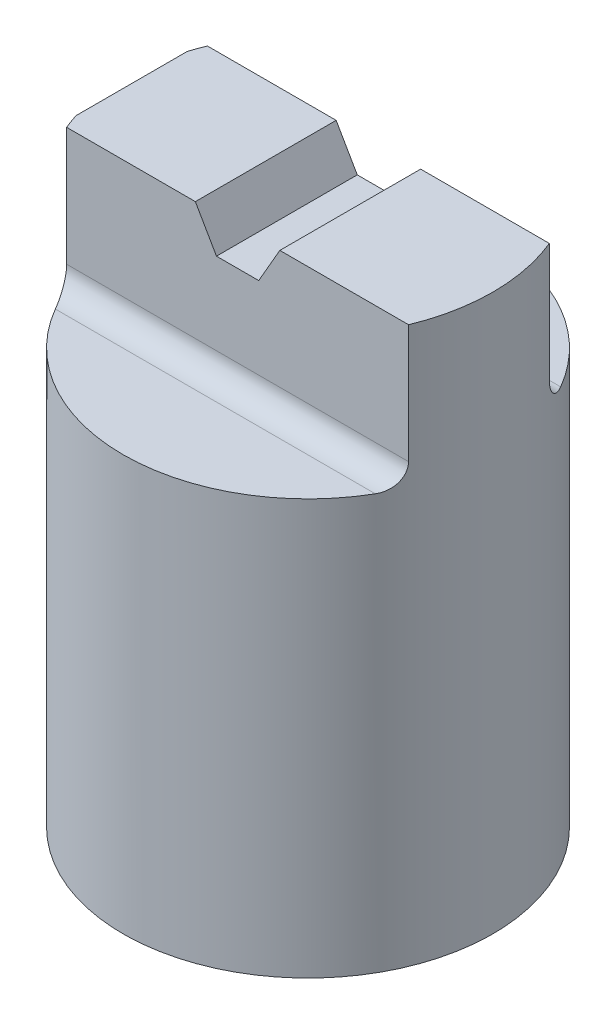
from build123d import *

# Parameters (mm, degrees)
CROQUIS4_R                  = 12.6746
SALIENTE_EXTRUIR6_DEPTH     = 38.1
CORTAR_EXTRUIR2_DEPTH       = 38.1
CORTAR_EXTRUIR2_DEPTH_BACK  = 38.1
CORTAR_EXTRUIR8_DEPTH       = 48.26
CORTAR_EXTRUIR10_DEPTH      = 55.88
CORTAR_EXTRUIR11_DEPTH      = 38.1
CORTAR_EXTRUIR11_DEPTH_BACK = 40.64
CORTAR_EXTRUIR12_DEPTH      = 0.254
CROQUIS36_W                 = 0.396875
CROQUIS36_H                 = 0.824278846
CORTAR_EXTRUIR13_DEPTH      = 0.254


with BuildPart() as part:
    # Croquis4 → Saliente-Extruir6 (new body)
    with BuildSketch(Plane(origin=(0, 0, 0), x_dir=(1, 0, 0), z_dir=(0, 1, 0))):
        with Locations(Location((0, 0, 0), (0, 0, 90))):
            Circle(CROQUIS4_R)
    extrude(amount=SALIENTE_EXTRUIR6_DEPTH)

    # Croquis7 → Cortar-Extruir2 (cut, two sides: drawn at the far end of the back side and taken through both)
    with BuildSketch(Plane.XY.offset(-CORTAR_EXTRUIR2_DEPTH_BACK)):
        Polygon((-2.8956, 38.1), (-1.4478, 35.5854), (1.4478, 35.5854), (2.8956, 38.1), align=None)
    extrude(amount=CORTAR_EXTRUIR2_DEPTH + CORTAR_EXTRUIR2_DEPTH_BACK, mode=Mode.SUBTRACT)

    # Croquis26 → Cortar-Extruir8 (cut)
    with BuildSketch(Plane(origin=(0, 0, 0), x_dir=(1, 0, 0), z_dir=(0, 1, 0))):
        with BuildLine():
            Line((-12.0904, 0), (-12.0904, -3.803644699))
            ThreePointArc((-12.0904, -3.803644699), (-12.6746, 0), (-12.0904, 3.803644699))
            Line((-12.0904, 3.803644699), (-12.0904, 0))
        make_face()
    extrude(amount=CORTAR_EXTRUIR8_DEPTH, mode=Mode.SUBTRACT)

    # Croquis32 → Cortar-Extruir10 (cut)
    with BuildSketch(Plane.XZ):
        with BuildLine():
            Line((0, -12.0904), (7.192790166, -12.0904))
            ThreePointArc((7.192790166, -12.0904), (0.79924589, -13.146144279), (-5.594298385, -12.0904))
            Line((-5.594298385, -12.0904), (0, -12.0904))
        make_face()
    extrude(amount=-CORTAR_EXTRUIR10_DEPTH, mode=Mode.SUBTRACT)

    # Croquis34 → Cortar-Extruir11 (cut, two sides: drawn at the far end of the back side and taken through both)
    with BuildSketch(Plane(origin=(0, 0, 0), x_dir=(0, 0, -1), z_dir=(1, 0, 0)).offset(-CORTAR_EXTRUIR11_DEPTH_BACK)):
        with BuildLine():
            Line((-4.826, 38.1), (-4.826, 29.972))
            ThreePointArc((-4.826, 29.972), (-5.272369265, 28.894369265), (-6.35, 28.448))
            Line((-6.35, 28.448), (-12.6746, 28.448))
            Line((-12.6746, 28.448), (-12.6746, 38.1))
            Line((-12.6746, 38.1), (-4.826, 38.1))
        make_face()
        with BuildLine():
            Line((4.826, 38.1), (4.826, 29.972))
            ThreePointArc((4.826, 29.972), (5.272369265, 28.894369265), (6.35, 28.448))
            Line((6.35, 28.448), (12.0904, 28.448))
            Line((12.0904, 28.448), (12.0904, 38.1))
            Line((12.0904, 38.1), (4.826, 38.1))
        make_face()
    extrude(amount=CORTAR_EXTRUIR11_DEPTH + CORTAR_EXTRUIR11_DEPTH_BACK, mode=Mode.SUBTRACT)

    # Croquis35 → Cortar-Extruir12 (cut)
    with BuildSketch(Plane.ZY.offset(12.0904)):
        with BuildLine():
            Line((0.041826923, 29.436302735), (0.041826923, 29.750405299))
            add(Edge.make_bspline(
                [(0.041826923, 29.750405299), (0.083498016, 29.748358494), (0.165338934, 29.744338625), (0.284659934, 29.725505405), (0.398725252, 29.698582372), (0.506556988, 29.660426155), (0.609443283, 29.61330656), (0.706017925, 29.55561854), (0.797239406, 29.488591911), (0.881380601, 29.412349634), (0.958296174, 29.329619737), (1.025419589, 29.240897901), (1.08148344, 29.147096017), (1.1286064, 29.049027685), (1.163934955, 28.945558713), (1.190159677, 28.837678151), (1.205935182, 28.724898389), (1.207631084, 28.648058453), (1.20849359, 28.608979017)],
                knots=[0, 0, 0, 0, 1.100776268, 2.161895295, 3.184016182, 4.190939212, 5.176500551, 6.166955529, 7.155448256, 8.160289653, 9.16017456, 10.133824356, 11.091467644, 12.04088621, 13.000931625, 13.972173743, 14.968683325, 16, 16, 16, 16], degree=3))
            add(Edge.make_bspline(
                [(1.20849359, 28.608979017), (1.207595133, 28.570600943), (1.205829698, 28.495189398), (1.190668669, 28.385127384), (1.166923078, 28.280350089), (1.133607661, 28.181062323), (1.088823234, 28.088056258), (1.035025695, 28.000633213), (0.972805864, 27.917752403), (0.89955205, 27.843145619), (0.821349666, 27.77463754), (0.737861762, 27.715535285), (0.651632477, 27.664922121), (0.562004275, 27.622734441), (0.468133247, 27.591678302), (0.371386044, 27.568100094), (0.270761233, 27.554772681), (0.202654677, 27.552727257), (0.168028846, 27.55168735)],
                knots=[0, 0, 0, 0, 1.111607364, 2.184268762, 3.212621178, 4.221274766, 5.211760367, 6.196651075, 7.1921475, 8.207485113, 9.220403448, 10.201281604, 11.166441695, 12.114753415, 13.065576456, 14.026450734, 14.996634279, 16, 16, 16, 16], degree=3))
            add(Edge.make_bspline(
                [(0.168028846, 27.55168735), (0.119281012, 27.553380613), (0.022640798, 27.556737424), (-0.119374065, 27.585451801), (-0.256967484, 27.630298312), (-0.367704786, 27.684295669), (-0.45693828, 27.738768113), (-0.530406985, 27.78785562), (-0.609512453, 27.845320431), (-0.69398979, 27.911998929), (-0.784500696, 27.986511802), (-0.880990491, 28.069533965), (-0.982462261, 28.161657447), (-1.051767862, 28.226315948), (-1.087680288, 28.259820363)],
                knots=[0, 0, 0, 0, 1.184426356, 2.348067706, 3.509069118, 4.696110526, 5.333549288, 6.050745305, 6.844228056, 7.710549037, 8.667450064, 9.695053472, 10.805634456, 12, 12, 12, 12], degree=3))
            Line((-1.087680288, 28.259820363), (-2.022275641, 29.135521485))
            Line((-2.022275641, 29.135521485), (-2.022275641, 27.506815555))
            Line((-2.022275641, 27.506815555), (-2.38125, 27.506815555))
            Line((-2.38125, 27.506815555), (-2.38125, 29.885020683))
            Line((-2.38125, 29.885020683), (-0.932732372, 28.527648889))
            add(Edge.make_bspline(
                [(-0.932732372, 28.527648889), (-0.898235947, 28.494598662), (-0.831975374, 28.431115941), (-0.735207659, 28.341364147), (-0.645540323, 28.260622937), (-0.562576029, 28.188838753), (-0.486785108, 28.125952529), (-0.417573603, 28.072165474), (-0.355535468, 28.027239858), (-0.282655661, 27.979628068), (-0.193568131, 27.934227066), (-0.085246136, 27.894324231), (0.026509457, 27.870167598), (0.102007707, 27.867254984), (0.139983974, 27.865789914)],
                knots=[0, 0, 0, 0, 1.329530082, 2.553755191, 3.672934919, 4.687409497, 5.60679272, 6.413407421, 7.126401618, 7.737995624, 8.834647426, 9.90044882, 10.943907757, 12, 12, 12, 12], degree=3))
            add(Edge.make_bspline(
                [(0.139983974, 27.865789914), (0.163868012, 27.866419126), (0.210938863, 27.867659182), (0.279906757, 27.878810578), (0.346692288, 27.895194192), (0.4104697, 27.920446402), (0.472493372, 27.950786003), (0.53087759, 27.98954708), (0.587612533, 28.033840813), (0.640752807, 28.085219371), (0.68943755, 28.14162348), (0.732560711, 28.201219665), (0.768600063, 28.264269264), (0.798143496, 28.330509522), (0.821318894, 28.399754954), (0.837377469, 28.472139709), (0.847459954, 28.547463723), (0.848824126, 28.598897219), (0.849519231, 28.625104818)],
                knots=[0, 0, 0, 0, 0.991504627, 1.954065223, 2.895985987, 3.842598665, 4.797835564, 5.759220273, 6.74786863, 7.784730864, 8.824135544, 9.839918996, 10.835834653, 11.835434876, 12.84861661, 13.863796685, 14.911511676, 16, 16, 16, 16], degree=3))
            add(Edge.make_bspline(
                [(0.849519231, 28.625104818), (0.848804415, 28.652475772), (0.847400634, 28.706227807), (0.837574902, 28.785145116), (0.820640229, 28.860437167), (0.797423151, 28.932256373), (0.768192666, 29.00067193), (0.731082364, 29.065065225), (0.687541169, 29.126024148), (0.637906583, 29.183436738), (0.582384417, 29.236189901), (0.521253649, 29.283513774), (0.454116634, 29.323876036), (0.382489792, 29.359655364), (0.304468657, 29.387031845), (0.221943858, 29.410432998), (0.133742916, 29.427432205), (0.072974465, 29.433296781), (0.041826923, 29.436302735)],
                knots=[0, 0, 0, 0, 1.031212865, 2.025131798, 2.990757446, 3.934781266, 4.865570067, 5.788494791, 6.729227313, 7.684356718, 8.643577152, 9.610526866, 10.590658432, 11.59095419, 12.621640561, 13.700587263, 14.82141059, 16, 16, 16, 16], degree=3))
        make_face()
        with BuildLine():
            Line((0.311057692, 32.128610427), (0.311057692, 32.442712991))
            add(Edge.make_bspline(
                [(0.311057692, 32.442712991), (0.346290176, 32.43420344), (0.415166801, 32.417567965), (0.513574062, 32.382870391), (0.606697583, 32.345071136), (0.692793657, 32.299682032), (0.773592559, 32.250173277), (0.847261684, 32.193450556), (0.915674649, 32.132130833), (0.976387887, 32.064305884), (1.031365616, 31.993177222), (1.078240673, 31.917742603), (1.118564826, 31.839519709), (1.151785058, 31.757966576), (1.176810582, 31.672840404), (1.194967387, 31.584910781), (1.206758502, 31.493947281), (1.207909265, 31.43219969), (1.20849359, 31.400846004)],
                knots=[0, 0, 0, 0, 1.162005537, 2.271625781, 3.343758855, 4.383309926, 5.390229558, 6.379919256, 7.361854164, 8.333198761, 9.295911338, 10.242430842, 11.177959212, 12.116337295, 13.062827104, 14.020064771, 14.994644689, 16, 16, 16, 16], degree=3))
            add(Edge.make_bspline(
                [(1.20849359, 31.400846004), (1.207114359, 31.355163262), (1.204385984, 31.264794251), (1.179471548, 31.132031204), (1.140046415, 31.004004385), (1.085572688, 30.882115137), (1.018385375, 30.768896704), (0.938420638, 30.668160518), (0.847221337, 30.581272007), (0.746488772, 30.508377629), (0.638833263, 30.45130263), (0.528033106, 30.409216257), (0.414351134, 30.383594576), (0.337593855, 30.380274019), (0.299138622, 30.378610427)],
                knots=[0, 0, 0, 0, 1.083050992, 2.142477498, 3.193116406, 4.255571735, 5.30263384, 6.308962982, 7.297363603, 8.282367274, 9.249857812, 10.179914175, 11.08814088, 12, 12, 12, 12], degree=3))
            add(Edge.make_bspline(
                [(0.299138622, 30.378610427), (0.262131827, 30.379774018), (0.189715273, 30.382050985), (0.083993775, 30.401384691), (-0.015647825, 30.433920954), (-0.109628987, 30.478990716), (-0.197353827, 30.537332266), (-0.279019718, 30.608004963), (-0.354988876, 30.691507625), (-0.398508349, 30.754786563), (-0.420913462, 30.787364433)],
                knots=[0, 0, 0, 0, 1.024540389, 2.004866551, 2.965041327, 3.920577974, 4.882998113, 5.874504559, 6.905732034, 8, 8, 8, 8], degree=3))
            add(Edge.make_bspline(
                [(-0.420913462, 30.787364433), (-0.438891633, 30.750132679), (-0.474511591, 30.676365805), (-0.544367348, 30.575815275), (-0.625023696, 30.4845374), (-0.687966348, 30.433633681), (-0.719591346, 30.408057542)],
                knots=[0, 0, 0, 0, 1.015518401, 2.012035669, 3.001164323, 4, 4, 4, 4], degree=3))
            add(Edge.make_bspline(
                [(-0.719591346, 30.408057542), (-0.74264664, 30.391209345), (-0.788379683, 30.35778885), (-0.861952008, 30.31665347), (-0.93609624, 30.278908986), (-1.013727633, 30.251130138), (-1.09235253, 30.227158093), (-1.173654605, 30.211385286), (-1.256861419, 30.201259775), (-1.313178124, 30.199837946), (-1.341486378, 30.199123247)],
                knots=[0, 0, 0, 0, 1.02516404, 2.033540309, 3.025129118, 4.011046665, 4.991655828, 5.976607087, 6.982917762, 8, 8, 8, 8], degree=3))
            add(Edge.make_bspline(
                [(-1.341486378, 30.199123247), (-1.390494151, 30.200921712), (-1.488279064, 30.204510179), (-1.632783018, 30.236454982), (-1.773793757, 30.286263725), (-1.909221962, 30.355759594), (-2.035668539, 30.441744239), (-2.148290569, 30.544607245), (-2.245749483, 30.661848029), (-2.326916131, 30.792699273), (-2.391845947, 30.934403957), (-2.436900154, 31.085982935), (-2.466247035, 31.245232067), (-2.469393782, 31.354439492), (-2.47099359, 31.409960587)],
                knots=[0, 0, 0, 0, 0.95570045, 1.906903359, 2.87519758, 3.868912786, 4.869932978, 5.851730567, 6.836639976, 7.83677598, 8.849487602, 9.869908895, 10.917060885, 12, 12, 12, 12], degree=3))
            add(Edge.make_bspline(
                [(-2.47099359, 31.409960587), (-2.470125376, 31.447379888), (-2.468417022, 31.521008593), (-2.456738421, 31.629252091), (-2.435408416, 31.73257379), (-2.406705111, 31.831113388), (-2.370313368, 31.924958425), (-2.32499467, 32.01382253), (-2.271683168, 32.098252423), (-2.209749581, 32.177451374), (-2.140468241, 32.251409942), (-2.062609231, 32.318162666), (-1.977611827, 32.378822459), (-1.884488771, 32.431765098), (-1.784443513, 32.479402051), (-1.676195015, 32.518583007), (-1.560710993, 32.553068576), (-1.480233253, 32.56910204), (-1.438942308, 32.577328376)],
                knots=[0, 0, 0, 0, 1.048658725, 2.063410685, 3.046034179, 4.001477787, 4.936774919, 5.862367409, 6.792675028, 7.730719943, 8.675894397, 9.627829632, 10.600096036, 11.597688215, 12.626045268, 13.701542398, 14.82072376, 16, 16, 16, 16], degree=3))
            Line((-1.438942308, 32.577328376), (-1.438942308, 32.263225812))
            add(Edge.make_bspline(
                [(-1.438942308, 32.263225812), (-1.465891321, 32.25504252), (-1.518309493, 32.239125307), (-1.593749798, 32.212031009), (-1.662907851, 32.181162737), (-1.726290973, 32.148048179), (-1.784523376, 32.113269733), (-1.836065245, 32.074354808), (-1.883180447, 32.034185662), (-1.909725059, 32.003906309), (-1.922716346, 31.98908719)],
                knots=[0, 0, 0, 0, 1.198163088, 2.33053128, 3.407730985, 4.417276592, 5.372219308, 6.28897303, 7.162600585, 8, 8, 8, 8], degree=3))
            add(Edge.make_bspline(
                [(-1.922716346, 31.98908719), (-1.93782468, 31.969490613), (-1.967994712, 31.93035795), (-2.00649634, 31.866589719), (-2.039857366, 31.799524833), (-2.065341061, 31.727710159), (-2.086918722, 31.652695389), (-2.101039241, 31.573268023), (-2.110727413, 31.490128806), (-2.111582344, 31.433361043), (-2.112019231, 31.404351613)],
                knots=[0, 0, 0, 0, 0.946170439, 1.889420265, 2.845303464, 3.807233317, 4.801018734, 5.828864929, 6.890507805, 8, 8, 8, 8], degree=3))
            add(Edge.make_bspline(
                [(-2.112019231, 31.404351613), (-2.111404327, 31.371597667), (-2.110201936, 31.307550153), (-2.099112235, 31.214101488), (-2.083031823, 31.125171908), (-2.057878932, 31.041668939), (-2.027703885, 30.962456311), (-1.988199209, 30.889302278), (-1.943585065, 30.820056203), (-1.891690234, 30.756746675), (-1.835597539, 30.699670039), (-1.776088189, 30.65034952), (-1.71500736, 30.60763231), (-1.650930161, 30.573294802), (-1.584485137, 30.546132221), (-1.515423583, 30.527652232), (-1.444327042, 30.514799862), (-1.395997975, 30.513753365), (-1.371634615, 30.513225812)],
                knots=[0, 0, 0, 0, 1.216990249, 2.379719373, 3.493992396, 4.571561497, 5.616923107, 6.638958652, 7.655775068, 8.674704564, 9.676001865, 10.625896028, 11.54399481, 12.441854662, 13.322657739, 14.20572845, 15.095482574, 16, 16, 16, 16], degree=3))
            add(Edge.make_bspline(
                [(-1.371634615, 30.513225812), (-1.33902324, 30.514756086), (-1.273962758, 30.51780902), (-1.178245736, 30.541118007), (-1.08602017, 30.579455283), (-0.998872816, 30.633134014), (-0.918064657, 30.69844596), (-0.846246013, 30.774758903), (-0.786389314, 30.862260041), (-0.745186208, 30.943312717), (-0.71772607, 31.015279721), (-0.698471535, 31.07674526), (-0.683079802, 31.145618676), (-0.66819136, 31.221073159), (-0.655709835, 31.303426936), (-0.645256069, 31.392754205), (-0.636904554, 31.489090902), (-0.633172953, 31.555781934), (-0.63125, 31.590148889)],
                knots=[0, 0, 0, 0, 1.070481957, 2.135637345, 3.216366529, 4.339485895, 5.485746587, 6.620975969, 7.768829582, 8.956804399, 9.598399438, 10.297751078, 11.070570279, 11.915248466, 12.824061284, 13.805856426, 14.869322739, 16, 16, 16, 16], degree=3))
            Line((-0.63125, 31.590148889), (-0.272275641, 31.590148889))
            add(Edge.make_bspline(
                [(-0.272275641, 31.590148889), (-0.271537633, 31.54684892), (-0.270092058, 31.462034917), (-0.252729148, 31.338123765), (-0.228440721, 31.219493483), (-0.192096321, 31.10885194), (-0.148472667, 31.008334931), (-0.099283811, 30.920649582), (-0.043555045, 30.847874001), (0.017982246, 30.789826365), (0.084752421, 30.747221461), (0.153615919, 30.715242261), (0.226174963, 30.696494758), (0.275664947, 30.693978019), (0.300540865, 30.692712991)],
                knots=[0, 0, 0, 0, 1.321708579, 2.588902423, 3.815526512, 5.016621128, 6.138757764, 7.158873101, 8.079948563, 8.928590313, 9.728601868, 10.489025425, 11.240515403, 12, 12, 12, 12], degree=3))
            add(Edge.make_bspline(
                [(0.300540865, 30.692712991), (0.318818654, 30.693127354), (0.355181449, 30.693951709), (0.408305873, 30.704349694), (0.459809226, 30.719971093), (0.509457816, 30.741460946), (0.556963459, 30.77017231), (0.602384437, 30.804635511), (0.646481957, 30.844867184), (0.68714634, 30.891918781), (0.725503266, 30.942857154), (0.758661402, 30.998161599), (0.786766216, 31.05661231), (0.809986783, 31.118263037), (0.827443025, 31.18336075), (0.83997972, 31.251586697), (0.847817137, 31.32307455), (0.848945586, 31.371846259), (0.849519231, 31.396639273)],
                knots=[0, 0, 0, 0, 0.884317272, 1.759307272, 2.611736065, 3.488921043, 4.37244062, 5.294096728, 6.247679003, 7.258495569, 8.302441962, 9.333537773, 10.376747089, 11.440883505, 12.520330301, 13.637364711, 14.798958396, 16, 16, 16, 16], degree=3))
            add(Edge.make_bspline(
                [(0.849519231, 31.396639273), (0.848130568, 31.436492258), (0.845418186, 31.514334407), (0.821577569, 31.626530975), (0.783804571, 31.730725203), (0.738193787, 31.810100186), (0.693324995, 31.868812931), (0.654724373, 31.911572902), (0.610959174, 31.952797895), (0.560828968, 31.990870202), (0.506057529, 32.028071198), (0.446343197, 32.064045669), (0.380834624, 32.097638113), (0.334767108, 32.118086384), (0.311057692, 32.128610427)],
                knots=[0, 0, 0, 0, 1.4727372, 2.876598283, 4.222346151, 5.558423782, 6.24313385, 6.953189256, 7.68715613, 8.463578749, 9.278833271, 10.135787152, 11.040551781, 12, 12, 12, 12], degree=3))
        make_face()
        Polygon((1.20849359, 32.846559145), (-2.874839744, 34.310501453), (-2.874839744, 34.64143094), (1.20849359, 33.177488632), align=None)
        Polygon((1.11875, 37.154251453), (1.11875, 35.000405299), (-2.47099359, 36.840148889), (-2.321654647, 37.111483023), (0.759775641, 35.531855619), (0.759775641, 37.154251453), align=None)
    extrude(amount=-CORTAR_EXTRUIR12_DEPTH, mode=Mode.SUBTRACT)

    # Croquis36 → Cortar-Extruir13 (cut)
    # profile 1 of 10: a face of its own
    with BuildSketch(Plane.XZ):
        with BuildLine():
            Line((-8.428764122, -8.563341346), (-8.428764122, -8.1359375))
            Line((-8.428764122, -8.1359375), (-6.87942518, -8.1359375))
            add(Edge.make_bspline(
                [(-6.87942518, -8.1359375), (-6.863362417, -8.135913315), (-6.832337355, -8.135866601), (-6.787824768, -8.133632054), (-6.746756653, -8.131526022), (-6.7094659, -8.127942675), (-6.675836751, -8.122321942), (-6.645745306, -8.117074197), (-6.619459735, -8.109879442), (-6.589519399, -8.099105263), (-6.555884642, -8.082284335), (-6.520432227, -8.055604857), (-6.488876585, -8.023745041), (-6.462380996, -7.986225239), (-6.439970721, -7.944335684), (-6.425148202, -7.89725085), (-6.415094353, -7.846501397), (-6.414279328, -7.811144215), (-6.413860276, -7.792964994)],
                knots=[0, 0, 0, 0, 1.155195489, 2.231248153, 3.20507519, 4.113220553, 4.92363642, 5.657123012, 6.309133385, 6.880755525, 7.944644177, 8.999147208, 10.058600405, 11.156792429, 12.29246015, 13.460660758, 14.694375292, 16, 16, 16, 16], degree=3))
            add(Edge.make_bspline(
                [(-6.413860276, -7.792964994), (-6.414423237, -7.773672761), (-6.415520917, -7.736056174), (-6.426295827, -7.681950701), (-6.443453173, -7.631821675), (-6.467941079, -7.586730491), (-6.497294129, -7.546722046), (-6.530765796, -7.512855677), (-6.568422873, -7.48612867), (-6.603164311, -7.46870835), (-6.635140987, -7.458929247), (-6.663710214, -7.451593473), (-6.697266518, -7.446266783), (-6.735576832, -7.441279903), (-6.778920288, -7.438452645), (-6.827070314, -7.435232831), (-6.880056207, -7.434078179), (-6.916950512, -7.43387828), (-6.936189753, -7.433774038)],
                knots=[0, 0, 0, 0, 1.26131785, 2.459356261, 3.594833267, 4.716926138, 5.803419038, 6.833631221, 7.818372604, 8.814377287, 9.360705024, 10.004324776, 10.743421339, 11.582437492, 12.532246195, 13.585177397, 14.740744533, 16, 16, 16, 16], degree=3))
            Line((-6.936189753, -7.433774038), (-8.428764122, -7.433774038))
            Line((-8.428764122, -7.433774038), (-8.428764122, -7.006370192))
            Line((-8.428764122, -7.006370192), (-7.00821875, -7.006370192))
            add(Edge.make_bspline(
                [(-7.00821875, -7.006370192), (-6.979438568, -7.006429545), (-6.924097086, -7.006543675), (-6.844567482, -7.008296362), (-6.771929946, -7.012027516), (-6.706163253, -7.015161254), (-6.647356003, -7.021226112), (-6.595257068, -7.02754427), (-6.550051087, -7.035597311), (-6.498589538, -7.047579729), (-6.439333662, -7.068257985), (-6.371102092, -7.101593332), (-6.304303144, -7.143913113), (-6.239652327, -7.193922421), (-6.179651608, -7.25042723), (-6.126828932, -7.311929084), (-6.082876871, -7.378145857), (-6.047339616, -7.448771689), (-6.019976144, -7.524551855), (-6.000634945, -7.605665084), (-5.988327605, -7.692575236), (-5.987092657, -7.752534546), (-5.98645643, -7.78342473)],
                knots=[0, 0, 0, 0, 1.170930413, 2.251584989, 3.235934929, 4.130173708, 4.929654547, 5.640582214, 6.264911921, 6.796838084, 7.789064304, 8.810388137, 9.880124863, 11.000704429, 12.131026409, 13.227749078, 14.29171941, 15.356377855, 16.43689688, 17.561893293, 18.743922147, 20, 20, 20, 20], degree=3))
            add(Edge.make_bspline(
                [(-5.98645643, -7.78342473), (-5.986803168, -7.803951154), (-5.987487276, -7.844449368), (-5.993487815, -7.904014245), (-6.002403074, -7.961575689), (-6.015157297, -8.017164235), (-6.032567702, -8.070588202), (-6.053142555, -8.122193365), (-6.076684094, -8.17216666), (-6.105254439, -8.218946354), (-6.135264301, -8.263681663), (-6.168099727, -8.3048718), (-6.202304612, -8.343150084), (-6.238661883, -8.378071905), (-6.276912547, -8.409669905), (-6.317094045, -8.437919527), (-6.359215745, -8.462768027), (-6.404033374, -8.484843865), (-6.453826118, -8.503736658), (-6.510363404, -8.519671978), (-6.574384164, -8.533524904), (-6.646310153, -8.544011623), (-6.725813883, -8.553254361), (-6.813198758, -8.559243275), (-6.908182025, -8.562334593), (-6.974030593, -8.562997282), (-7.00821875, -8.563341346)],
                knots=[0, 0, 0, 0, 1.001237316, 1.975420686, 2.917953599, 3.841913885, 4.754568974, 5.656377887, 6.55158913, 7.445656762, 8.327865759, 9.178398172, 10.013362476, 10.830881591, 11.635451955, 12.431789376, 13.224756564, 14.019278107, 14.866442763, 15.819105778, 16.882716987, 18.059987251, 19.363897986, 20.787153213, 22.331910422, 24, 24, 24, 24], degree=3))
            Line((-7.00821875, -8.563341346), (-8.428764122, -8.563341346))
        make_face()
    # profile 2 of 10: a face of its own
    with BuildSketch(Plane.XZ):
        Polygon((-8.428764122, -6.701081731), (-8.428764122, -5.418870192), (-8.001360276, -5.418870192), (-8.001360276, -5.846274038), (-6.047514122, -5.846274038), (-6.047514122, -6.273677885), (-8.001360276, -6.273677885), (-8.001360276, -6.701081731), align=None)
    # profile 3 of 10: a face of its own
    with BuildSketch(Plane.XZ):
        with BuildLine():
            Line((-7.635014122, -4.808293269), (-7.635014122, -5.235697115))
            add(Edge.make_bspline(
                [(-7.635014122, -5.235697115), (-7.6673453, -5.233851948), (-7.730518481, -5.230246603), (-7.822273876, -5.21588972), (-7.908993847, -5.196701422), (-7.990417682, -5.170873498), (-8.066579588, -5.139060616), (-8.137227284, -5.100470989), (-8.202866994, -5.056256766), (-8.262347527, -5.005526727), (-8.315822335, -4.950339759), (-8.362571416, -4.890837341), (-8.401706511, -4.827188499), (-8.433809208, -4.759818838), (-8.4594955, -4.688992977), (-8.476659824, -4.613995323), (-8.488286187, -4.53548763), (-8.489303376, -4.481742281), (-8.489821815, -4.454349459)],
                knots=[0, 0, 0, 0, 1.198928049, 2.342633425, 3.435730849, 4.486331048, 5.502589352, 6.488331875, 7.46361919, 8.428949135, 9.378681775, 10.305958057, 11.226249248, 12.140413166, 13.066341608, 14.010670971, 14.986082777, 16, 16, 16, 16], degree=3))
            add(Edge.make_bspline(
                [(-8.489821815, -4.454349459), (-8.488843176, -4.42071006), (-8.486931806, -4.355009212), (-8.46847249, -4.259857996), (-8.440205072, -4.170516441), (-8.399136413, -4.08793489), (-8.347348503, -4.012256919), (-8.285479688, -3.943903274), (-8.21277837, -3.884207068), (-8.13133816, -3.833633862), (-8.044932206, -3.791812486), (-7.955748043, -3.76222454), (-7.866087476, -3.742879174), (-7.805721735, -3.740811059), (-7.775733023, -3.739783654)],
                knots=[0, 0, 0, 0, 1.075374184, 2.100304875, 3.089917907, 4.066149699, 5.039978333, 6.01615708, 7.006437042, 8.039858286, 9.077679641, 10.07047942, 11.041445745, 12, 12, 12, 12], degree=3))
            add(Edge.make_bspline(
                [(-7.775733023, -3.739783654), (-7.75759338, -3.740183158), (-7.72108276, -3.740987262), (-7.665833231, -3.746578301), (-7.609555127, -3.754965967), (-7.552296695, -3.767612513), (-7.494041914, -3.783383829), (-7.43461633, -3.802516573), (-7.374357324, -3.825455225), (-7.312584877, -3.851814335), (-7.249105719, -3.883269695), (-7.18293823, -3.919858588), (-7.11415285, -3.962804262), (-7.042074891, -4.010708707), (-6.9678049, -4.065456495), (-6.890518168, -4.125597409), (-6.810336477, -4.191434183), (-6.756715236, -4.238124726), (-6.729166015, -4.262113131)],
                knots=[0, 0, 0, 0, 0.728277616, 1.465842947, 2.227925269, 3.011838508, 3.818735656, 4.650581052, 5.517389122, 6.406849312, 7.346234817, 8.360743166, 9.441530624, 10.601362564, 11.834937575, 13.145232671, 14.533293658, 16, 16, 16, 16], degree=3))
            Line((-6.729166015, -4.262113131), (-6.444389122, -4.510637019))
            Line((-6.444389122, -4.510637019), (-6.444389122, -3.709254808))
            Line((-6.444389122, -3.709254808), (-6.047514122, -3.709254808))
            Line((-6.047514122, -3.709254808), (-6.047514122, -5.296754808))
            Line((-6.047514122, -5.296754808), (-6.264078125, -5.296754808))
            Line((-6.264078125, -5.296754808), (-7.014419922, -4.591729267))
            add(Edge.make_bspline(
                [(-7.014419922, -4.591729267), (-7.036307407, -4.571316642), (-7.078696975, -4.531783442), (-7.140954123, -4.475537022), (-7.200021918, -4.424620249), (-7.25658535, -4.380171614), (-7.308729256, -4.339501849), (-7.358424874, -4.305478599), (-7.404272689, -4.275848516), (-7.460159351, -4.244896765), (-7.526310715, -4.214826319), (-7.602472697, -4.1872522), (-7.675317056, -4.170612353), (-7.722868987, -4.168297845), (-7.74568119, -4.1671875)],
                knots=[0, 0, 0, 0, 1.246192343, 2.413505005, 3.49357156, 4.492416076, 5.408771964, 6.246246772, 6.999304986, 7.680960093, 8.904522682, 10.020616941, 11.0504258, 12, 12, 12, 12], degree=3))
            add(Edge.make_bspline(
                [(-7.74568119, -4.1671875), (-7.767751024, -4.168015487), (-7.810514866, -4.169619845), (-7.871346204, -4.187250439), (-7.92642277, -4.214564366), (-7.974098816, -4.253053546), (-8.013277384, -4.299675999), (-8.042417302, -4.353552622), (-8.059230901, -4.414244163), (-8.061335363, -4.45679009), (-8.062417968, -4.478677133)],
                knots=[0, 0, 0, 0, 1.062038974, 2.057870785, 3.028805853, 4.01125022, 4.991535629, 5.949134679, 6.94496649, 8, 8, 8, 8], degree=3))
            add(Edge.make_bspline(
                [(-8.062417968, -4.478677133), (-8.062018041, -4.489984259), (-8.06123072, -4.512244151), (-8.055989735, -4.544964453), (-8.046753046, -4.576100171), (-8.034377183, -4.605997863), (-8.017972887, -4.634338452), (-7.997751979, -4.661050456), (-7.974228319, -4.686415319), (-7.94747546, -4.710316707), (-7.917619262, -4.73207009), (-7.8849324, -4.751391366), (-7.849435164, -4.767366844), (-7.811596171, -4.781432236), (-7.771009, -4.792280139), (-7.72791656, -4.800178758), (-7.682388957, -4.806183551), (-7.651093011, -4.807577237), (-7.635014122, -4.808293269)],
                knots=[0, 0, 0, 0, 0.903469896, 1.778625579, 2.63899355, 3.493148037, 4.358286772, 5.247621495, 6.164656832, 7.118446693, 8.109501108, 9.111810964, 10.146451449, 11.215617525, 12.33435995, 13.498009769, 14.714554818, 16, 16, 16, 16], degree=3))
        make_face()
    # profile 4 of 10: a face of its own
    with BuildSketch(Plane.XZ):
        with BuildLine():
            add(Edge.make_bspline(
                [(-8.489821815, -2.602107121), (-8.489514757, -2.581418969), (-8.488910999, -2.540740533), (-8.482369565, -2.480829412), (-8.47249194, -2.423116299), (-8.458699596, -2.367385384), (-8.440505185, -2.314001596), (-8.418544865, -2.262778184), (-8.39261136, -2.213761359), (-8.362585436, -2.166899203), (-8.328003477, -2.122610285), (-8.289874771, -2.080178517), (-8.246725765, -2.041305232), (-8.199673139, -2.004815791), (-8.148435571, -1.970959404), (-8.093162291, -1.939517423), (-8.033512163, -1.910803275), (-7.969397525, -1.884474486), (-7.899851624, -1.860932405), (-7.824078386, -1.841102603), (-7.742060026, -1.82409533), (-7.653592529, -1.809739962), (-7.55855826, -1.798889632), (-7.457020366, -1.79157629), (-7.349174595, -1.786557528), (-7.275193282, -1.786147932), (-7.237185096, -1.7859375)],
                knots=[0, 0, 0, 0, 0.879187688, 1.728717895, 2.558878706, 3.367146394, 4.166631857, 4.95393622, 5.734098362, 6.521634849, 7.316678452, 8.120609651, 8.943639266, 9.781961388, 10.650008082, 11.55217958, 12.483362701, 13.462505087, 14.497127373, 15.602264045, 16.790140859, 18.057036744, 19.411188506, 20.855078804, 22.384284574, 24, 24, 24, 24], degree=3))
            add(Edge.make_bspline(
                [(-7.237185096, -1.7859375), (-7.198701395, -1.786164957), (-7.123928256, -1.786606903), (-7.015095929, -1.791367257), (-6.912821306, -1.799567469), (-6.817112134, -1.810128156), (-6.728028565, -1.824622095), (-6.645457883, -1.841472833), (-6.5693845, -1.8617962), (-6.499802199, -1.885977966), (-6.435513346, -1.912347284), (-6.37574292, -1.940683072), (-6.320934376, -1.972214146), (-6.269351869, -2.004066854), (-6.22325045, -2.039795396), (-6.180816196, -2.07675415), (-6.143673093, -2.116821417), (-6.109877564, -2.158263251), (-6.080672826, -2.202610063), (-6.055130474, -2.249401346), (-6.034412688, -2.299472156), (-6.016393437, -2.351909558), (-6.003457565, -2.40760742), (-5.993193374, -2.465680696), (-5.987520753, -2.526785024), (-5.986817027, -2.568387312), (-5.98645643, -2.589704778)],
                knots=[0, 0, 0, 0, 1.643824397, 3.193921316, 4.652018541, 6.026147715, 7.305813021, 8.506024873, 9.624771103, 10.66654028, 11.650369642, 12.592128821, 13.489360096, 14.35046321, 15.179132238, 15.977837183, 16.751455772, 17.509897991, 18.259653136, 19.016390304, 19.783391144, 20.571659993, 21.382176161, 22.223003704, 23.089447706, 24, 24, 24, 24], degree=3))
            add(Edge.make_bspline(
                [(-5.98645643, -2.589704778), (-5.986824055, -2.61102163), (-5.987544228, -2.65278103), (-5.993150389, -2.714051131), (-6.003502015, -2.772430221), (-6.016482441, -2.82857571), (-6.034410237, -2.882055757), (-6.055602653, -2.933345112), (-6.081664811, -2.981429571), (-6.110811982, -3.027299917), (-6.144402376, -3.070231695), (-6.181908207, -3.110861315), (-6.222803737, -3.149757106), (-6.268510009, -3.185533335), (-6.318192114, -3.218829883), (-6.371843169, -3.250000111), (-6.429638547, -3.278410886), (-6.491562624, -3.305012355), (-6.55910126, -3.328547273), (-6.63288952, -3.348841592), (-6.713479995, -3.366031042), (-6.800792038, -3.379541117), (-6.894837262, -3.390435789), (-6.995540213, -3.398515065), (-7.102938078, -3.403304435), (-7.17675839, -3.403741381), (-7.214765474, -3.403966346)],
                knots=[0, 0, 0, 0, 0.917318694, 1.797013832, 2.644089644, 3.467281984, 4.274391433, 5.068665368, 5.852346333, 6.624865025, 7.405043053, 8.194438745, 9.002823433, 9.831034161, 10.688848002, 11.574933485, 12.499091769, 13.45866927, 14.473616003, 15.574277631, 16.749933499, 18.017757418, 19.374908438, 20.82337846, 22.364486432, 24, 24, 24, 24], degree=3))
            add(Edge.make_bspline(
                [(-7.214765474, -3.403966346), (-7.267573275, -3.403558569), (-7.369466608, -3.402771757), (-7.516672848, -3.392800701), (-7.652739516, -3.37816572), (-7.777439008, -3.356670399), (-7.891233174, -3.330091732), (-7.993372397, -3.296056366), (-8.085270002, -3.257309576), (-8.139710696, -3.224292334), (-8.165929837, -3.208390925)],
                knots=[0, 0, 0, 0, 1.288568992, 2.486310467, 3.599230591, 4.627010532, 5.572937695, 6.447898582, 7.252493626, 8, 8, 8, 8], degree=3))
            add(Edge.make_bspline(
                [(-8.165929837, -3.208390925), (-8.191687514, -3.189901525), (-8.242048846, -3.153751103), (-8.308163861, -3.090541081), (-8.36470866, -3.022630141), (-8.410403583, -2.948623433), (-8.446438602, -2.869691403), (-8.471889731, -2.785156379), (-8.486718744, -2.695330536), (-8.488772012, -2.63364563), (-8.489821815, -2.602107121)],
                knots=[0, 0, 0, 0, 1.058512271, 2.069600068, 3.047294572, 4.004278952, 4.967380941, 5.939006123, 6.946246673, 8, 8, 8, 8], degree=3))
        make_face()
        with BuildLine():
            add(Edge.make_bspline(
                [(-8.062417968, -2.591612831), (-8.061528805, -2.610313145), (-8.059785574, -2.646975688), (-8.045072076, -2.700207724), (-8.022174293, -2.750186762), (-7.995311263, -2.788626189), (-7.969016242, -2.817071718), (-7.945244938, -2.837039497), (-7.918697966, -2.856287164), (-7.888191647, -2.873267383), (-7.854733185, -2.889464358), (-7.818226198, -2.904803982), (-7.778076092, -2.917994033), (-7.734553161, -2.930574011), (-7.686603637, -2.941454091), (-7.633764285, -2.950974097), (-7.575854699, -2.959084214), (-7.51263215, -2.964933377), (-7.444427928, -2.970303961), (-7.37094792, -2.974170961), (-7.292207561, -2.975784088), (-7.237980433, -2.976297528), (-7.209995342, -2.9765625)],
                knots=[0, 0, 0, 0, 1.076486532, 2.110485037, 3.16053299, 4.233735637, 4.798028448, 5.389657808, 6.0205397, 6.6857231, 7.399126456, 8.163539924, 8.966557062, 9.834164971, 10.774831688, 11.799768806, 12.928987201, 14.14492726, 15.459726247, 16.873396567, 18.386448164, 20, 20, 20, 20], degree=3))
            add(Edge.make_bspline(
                [(-7.209995342, -2.9765625), (-7.173739483, -2.976125305), (-7.104216185, -2.97528695), (-7.004236075, -2.970925265), (-6.913100494, -2.962079203), (-6.830456798, -2.951334616), (-6.756786801, -2.935817884), (-6.691436082, -2.918258129), (-6.634990906, -2.896466263), (-6.586773851, -2.871293778), (-6.545756128, -2.843411451), (-6.510890778, -2.813144574), (-6.480699054, -2.781522914), (-6.456174684, -2.747559632), (-6.437380338, -2.71133571), (-6.423861797, -2.673153562), (-6.415586535, -2.632988921), (-6.414439022, -2.605484589), (-6.413860276, -2.591612831)],
                knots=[0, 0, 0, 0, 1.771738815, 3.39744054, 4.888007323, 6.245018868, 7.467093912, 8.564230264, 9.548241846, 10.417081984, 11.216594933, 11.965786359, 12.669352538, 13.348558586, 14.005353126, 14.656563323, 15.322440191, 16, 16, 16, 16], degree=3))
            add(Edge.make_bspline(
                [(-6.413860276, -2.591612831), (-6.414256297, -2.578217106), (-6.415031657, -2.551989944), (-6.422990622, -2.513744868), (-6.435930169, -2.477577606), (-6.454234068, -2.443597359), (-6.477510276, -2.411682584), (-6.505861079, -2.381989262), (-6.539569068, -2.354741332), (-6.56458538, -2.338866565), (-6.577475811, -2.330686599)],
                knots=[0, 0, 0, 0, 0.992283464, 1.942767638, 2.88273346, 3.832339453, 4.79467288, 5.803907806, 6.868395428, 8, 8, 8, 8], degree=3))
            add(Edge.make_bspline(
                [(-6.577475811, -2.330686599), (-6.595090172, -2.321056066), (-6.63202606, -2.300861621), (-6.694353993, -2.277492574), (-6.764649599, -2.257821813), (-6.843131647, -2.240891476), (-6.930109678, -2.229312159), (-7.025032157, -2.219340065), (-7.128377076, -2.214530276), (-7.199974808, -2.213747938), (-7.237185096, -2.213341346)],
                knots=[0, 0, 0, 0, 0.710965849, 1.490837728, 2.352621235, 3.297892224, 4.334225155, 5.461620853, 6.680770821, 8, 8, 8, 8], degree=3))
            add(Edge.make_bspline(
                [(-7.237185096, -2.213341346), (-7.274718387, -2.213498404), (-7.346963564, -2.213800713), (-7.450680015, -2.219347207), (-7.54540778, -2.227071123), (-7.630935369, -2.238368983), (-7.707470408, -2.252905734), (-7.775007892, -2.270822333), (-7.833680925, -2.291944672), (-7.883431002, -2.316993248), (-7.925711742, -2.344736102), (-7.961985338, -2.374185989), (-7.992954819, -2.405467435), (-8.018736729, -2.438528126), (-8.038436041, -2.474133264), (-8.052345386, -2.511602745), (-8.060760073, -2.551013383), (-8.061857877, -2.577897018), (-8.062417968, -2.591612831)],
                knots=[0, 0, 0, 0, 1.793836731, 3.452829483, 4.963243077, 6.335886805, 7.574563692, 8.684454726, 9.672768357, 10.54971625, 11.340229787, 12.085688095, 12.778991901, 13.440269426, 14.083255152, 14.715733572, 15.344777694, 16, 16, 16, 16], degree=3))
        make_face(mode=Mode.SUBTRACT)
    # profile 5 of 10: a face of its own
    with BuildSketch(Plane.XZ):
        with BuildLine():
            add(Edge.make_bspline(
                [(-8.489821815, -0.739847506), (-8.489514757, -0.719159353), (-8.488910999, -0.678480918), (-8.482369565, -0.618569797), (-8.47249194, -0.560856684), (-8.458699596, -0.505125769), (-8.440505185, -0.451741981), (-8.418544865, -0.400518568), (-8.39261136, -0.351501743), (-8.362585436, -0.304639587), (-8.328003477, -0.260350669), (-8.289874771, -0.217918902), (-8.246725765, -0.179045617), (-8.199673139, -0.142556176), (-8.148435571, -0.108699789), (-8.093162291, -0.077257807), (-8.033512163, -0.04854366), (-7.969397525, -0.022214871), (-7.899851624, 0.00132721), (-7.824078386, 0.021157013), (-7.742060026, 0.038164285), (-7.653592529, 0.052519653), (-7.55855826, 0.063369983), (-7.457020366, 0.070683326), (-7.349174595, 0.075702087), (-7.275193282, 0.076111684), (-7.237185096, 0.076322115)],
                knots=[0, 0, 0, 0, 0.879187688, 1.728717895, 2.558878706, 3.367146394, 4.166631857, 4.95393622, 5.734098362, 6.521634849, 7.316678452, 8.120609651, 8.943639266, 9.781961388, 10.650008082, 11.55217958, 12.483362701, 13.462505087, 14.497127373, 15.602264045, 16.790140859, 18.057036744, 19.411188506, 20.855078804, 22.384284574, 24, 24, 24, 24], degree=3))
            add(Edge.make_bspline(
                [(-7.237185096, 0.076322115), (-7.198701395, 0.076094658), (-7.123928256, 0.075652713), (-7.015095929, 0.070892358), (-6.912821306, 0.062692147), (-6.817112134, 0.05213146), (-6.728028565, 0.03763752), (-6.645457883, 0.020786782), (-6.5693845, 0.000463415), (-6.499802199, -0.023718351), (-6.435513346, -0.050087669), (-6.37574292, -0.078423456), (-6.320934376, -0.10995453), (-6.269351869, -0.141807239), (-6.22325045, -0.17753578), (-6.180816196, -0.214494535), (-6.143673093, -0.254561801), (-6.109877564, -0.296003635), (-6.080672826, -0.340350447), (-6.055130474, -0.387141731), (-6.034412688, -0.437212541), (-6.016393437, -0.489649942), (-6.003457565, -0.545347805), (-5.993193374, -0.60342108), (-5.987520753, -0.664525409), (-5.986817027, -0.706127696), (-5.98645643, -0.727445162)],
                knots=[0, 0, 0, 0, 1.643824397, 3.193921316, 4.652018541, 6.026147715, 7.305813021, 8.506024873, 9.624771103, 10.66654028, 11.650369642, 12.592128821, 13.489360096, 14.35046321, 15.179132238, 15.977837183, 16.751455772, 17.509897991, 18.259653136, 19.016390304, 19.783391144, 20.571659993, 21.382176161, 22.223003704, 23.089447706, 24, 24, 24, 24], degree=3))
            add(Edge.make_bspline(
                [(-5.98645643, -0.727445162), (-5.986824055, -0.748762015), (-5.987544228, -0.790521415), (-5.993150389, -0.851791515), (-6.003502015, -0.910170606), (-6.016482441, -0.966316095), (-6.034410237, -1.019796141), (-6.055602653, -1.071085496), (-6.081664811, -1.119169956), (-6.110811982, -1.165040302), (-6.144402376, -1.20797208), (-6.181908207, -1.248601699), (-6.222803737, -1.28749749), (-6.268510009, -1.323273719), (-6.318192114, -1.356570267), (-6.371843169, -1.387740496), (-6.429638547, -1.41615127), (-6.491562624, -1.442752739), (-6.55910126, -1.466287658), (-6.63288952, -1.486581976), (-6.713479995, -1.503771426), (-6.800792038, -1.517281501), (-6.894837262, -1.528176173), (-6.995540213, -1.53625545), (-7.102938078, -1.54104482), (-7.17675839, -1.541481765), (-7.214765474, -1.541706731)],
                knots=[0, 0, 0, 0, 0.917318694, 1.797013832, 2.644089644, 3.467281984, 4.274391433, 5.068665368, 5.852346333, 6.624865025, 7.405043053, 8.194438745, 9.002823433, 9.831034161, 10.688848002, 11.574933485, 12.499091769, 13.45866927, 14.473616003, 15.574277631, 16.749933499, 18.017757418, 19.374908438, 20.82337846, 22.364486432, 24, 24, 24, 24], degree=3))
            add(Edge.make_bspline(
                [(-7.214765474, -1.541706731), (-7.267573275, -1.541298953), (-7.369466608, -1.540512142), (-7.516672848, -1.530541086), (-7.652739516, -1.515906104), (-7.777439008, -1.494410784), (-7.891233174, -1.467832117), (-7.993372397, -1.43379675), (-8.085270002, -1.395049961), (-8.139710696, -1.362032719), (-8.165929837, -1.34613131)],
                knots=[0, 0, 0, 0, 1.288568992, 2.486310467, 3.599230591, 4.627010532, 5.572937695, 6.447898582, 7.252493626, 8, 8, 8, 8], degree=3))
            add(Edge.make_bspline(
                [(-8.165929837, -1.34613131), (-8.191687514, -1.327641909), (-8.242048846, -1.291491488), (-8.308163861, -1.228281465), (-8.36470866, -1.160370526), (-8.410403583, -1.086363818), (-8.446438602, -1.007431787), (-8.471889731, -0.922896764), (-8.486718744, -0.83307092), (-8.488772012, -0.771386015), (-8.489821815, -0.739847506)],
                knots=[0, 0, 0, 0, 1.058512271, 2.069600068, 3.047294572, 4.004278952, 4.967380941, 5.939006123, 6.946246673, 8, 8, 8, 8], degree=3))
        make_face()
        with BuildLine():
            add(Edge.make_bspline(
                [(-8.062417968, -0.729353215), (-8.061528805, -0.74805353), (-8.059785574, -0.784716073), (-8.045072076, -0.837948108), (-8.022174293, -0.887927146), (-7.995311263, -0.926366574), (-7.969016242, -0.954812103), (-7.945244938, -0.974779882), (-7.918697966, -0.994027549), (-7.888191647, -1.011007767), (-7.854733185, -1.027204742), (-7.818226198, -1.042544366), (-7.778076092, -1.055734417), (-7.734553161, -1.068314395), (-7.686603637, -1.079194475), (-7.633764285, -1.088714481), (-7.575854699, -1.096824599), (-7.51263215, -1.102673762), (-7.444427928, -1.108044345), (-7.37094792, -1.111911346), (-7.292207561, -1.113524473), (-7.237980433, -1.114037913), (-7.209995342, -1.114302885)],
                knots=[0, 0, 0, 0, 1.076486532, 2.110485037, 3.16053299, 4.233735637, 4.798028448, 5.389657808, 6.0205397, 6.6857231, 7.399126456, 8.163539924, 8.966557062, 9.834164971, 10.774831688, 11.799768806, 12.928987201, 14.14492726, 15.459726247, 16.873396567, 18.386448164, 20, 20, 20, 20], degree=3))
            add(Edge.make_bspline(
                [(-7.209995342, -1.114302885), (-7.173739483, -1.113865689), (-7.104216185, -1.113027335), (-7.004236075, -1.10866565), (-6.913100494, -1.099819587), (-6.830456798, -1.089075001), (-6.756786801, -1.073558269), (-6.691436082, -1.055998513), (-6.634990906, -1.034206648), (-6.586773851, -1.009034163), (-6.545756128, -0.981151835), (-6.510890778, -0.950884959), (-6.480699054, -0.919263299), (-6.456174684, -0.885300017), (-6.437380338, -0.849076094), (-6.423861797, -0.810893946), (-6.415586535, -0.770729306), (-6.414439022, -0.743224974), (-6.413860276, -0.729353215)],
                knots=[0, 0, 0, 0, 1.771738815, 3.39744054, 4.888007323, 6.245018868, 7.467093912, 8.564230264, 9.548241846, 10.417081984, 11.216594933, 11.965786359, 12.669352538, 13.348558586, 14.005353126, 14.656563323, 15.322440191, 16, 16, 16, 16], degree=3))
            add(Edge.make_bspline(
                [(-6.413860276, -0.729353215), (-6.414256297, -0.715957491), (-6.415031657, -0.689730329), (-6.422990622, -0.651485252), (-6.435930169, -0.615317991), (-6.454234068, -0.581337744), (-6.477510276, -0.549422969), (-6.505861079, -0.519729646), (-6.539569068, -0.492481717), (-6.56458538, -0.476606949), (-6.577475811, -0.468426983)],
                knots=[0, 0, 0, 0, 0.992283464, 1.942767638, 2.88273346, 3.832339453, 4.79467288, 5.803907806, 6.868395428, 8, 8, 8, 8], degree=3))
            add(Edge.make_bspline(
                [(-6.577475811, -0.468426983), (-6.595090172, -0.458796451), (-6.63202606, -0.438602006), (-6.694353993, -0.415232959), (-6.764649599, -0.395562197), (-6.843131647, -0.378631861), (-6.930109678, -0.367052543), (-7.025032157, -0.357080449), (-7.128377076, -0.352270661), (-7.199974808, -0.351488322), (-7.237185096, -0.351081731)],
                knots=[0, 0, 0, 0, 0.710965849, 1.490837728, 2.352621235, 3.297892224, 4.334225155, 5.461620853, 6.680770821, 8, 8, 8, 8], degree=3))
            add(Edge.make_bspline(
                [(-7.237185096, -0.351081731), (-7.274718387, -0.351238788), (-7.346963564, -0.351541097), (-7.450680015, -0.357087591), (-7.54540778, -0.364811508), (-7.630935369, -0.376109368), (-7.707470408, -0.390646118), (-7.775007892, -0.408562718), (-7.833680925, -0.429685056), (-7.883431002, -0.454733633), (-7.925711742, -0.482476487), (-7.961985338, -0.511926374), (-7.992954819, -0.543207819), (-8.018736729, -0.57626851), (-8.038436041, -0.611873649), (-8.052345386, -0.649343129), (-8.060760073, -0.688753768), (-8.061857877, -0.715637403), (-8.062417968, -0.729353215)],
                knots=[0, 0, 0, 0, 1.793836731, 3.452829483, 4.963243077, 6.335886805, 7.574563692, 8.684454726, 9.672768357, 10.54971625, 11.340229787, 12.085688095, 12.778991901, 13.440269426, 14.083255152, 14.715733572, 15.344777694, 16, 16, 16, 16], degree=3))
        make_face(mode=Mode.SUBTRACT)
    # profile 6 of 10: a face of its own
    with BuildSketch(Plane.XZ):
        Polygon((-8.428764122, 0.758928035), (-8.428764122, 1.419591346), (-6.047514122, 1.419591346), (-6.047514122, 0.9921875), (-8.031889122, 0.9921875), (-8.031889122, 0.503725962), align=None)
    # profile 7 of 10: a face of its own
    with BuildSketch(Plane.XZ):
        with Locations((-6.917586238, 2.778125)):
            Rectangle(CROQUIS36_W, CROQUIS36_H)
    # profile 8 of 10: a face of its own
    with BuildSketch(Plane.XZ):
        with BuildLine():
            add(Edge.make_bspline(
                [(-8.489821815, 4.358469802), (-8.489514757, 4.379157954), (-8.488910999, 4.41983639), (-8.482369565, 4.479747511), (-8.47249194, 4.537460624), (-8.458699596, 4.593191539), (-8.440505185, 4.646575327), (-8.418544865, 4.697798739), (-8.39261136, 4.746815564), (-8.362585436, 4.79367772), (-8.328003477, 4.837966639), (-8.289874771, 4.880398406), (-8.246725765, 4.919271691), (-8.199673139, 4.955761132), (-8.148435571, 4.989617519), (-8.093162291, 5.0210595), (-8.033512163, 5.049773648), (-7.969397525, 5.076102437), (-7.899851624, 5.099644518), (-7.824078386, 5.11947432), (-7.742060026, 5.136481593), (-7.653592529, 5.150836961), (-7.55855826, 5.161687291), (-7.457020366, 5.169000634), (-7.349174595, 5.174019395), (-7.275193282, 5.174428991), (-7.237185096, 5.174639423)],
                knots=[0, 0, 0, 0, 0.879187688, 1.728717895, 2.558878706, 3.367146394, 4.166631857, 4.95393622, 5.734098362, 6.521634849, 7.316678452, 8.120609651, 8.943639266, 9.781961388, 10.650008082, 11.55217958, 12.483362701, 13.462505087, 14.497127373, 15.602264045, 16.790140859, 18.057036744, 19.411188506, 20.855078804, 22.384284574, 24, 24, 24, 24], degree=3))
            add(Edge.make_bspline(
                [(-7.237185096, 5.174639423), (-7.198701395, 5.174411966), (-7.123928256, 5.173970021), (-7.015095929, 5.169209666), (-6.912821306, 5.161009455), (-6.817112134, 5.150448767), (-6.728028565, 5.135954828), (-6.645457883, 5.11910409), (-6.5693845, 5.098780723), (-6.499802199, 5.074598957), (-6.435513346, 5.048229639), (-6.37574292, 5.019893851), (-6.320934376, 4.988362777), (-6.269351869, 4.956510069), (-6.22325045, 4.920781528), (-6.180816196, 4.883822773), (-6.143673093, 4.843755506), (-6.109877564, 4.802313673), (-6.080672826, 4.75796686), (-6.055130474, 4.711175577), (-6.034412688, 4.661104767), (-6.016393437, 4.608667365), (-6.003457565, 4.552969503), (-5.993193374, 4.494896227), (-5.987520753, 4.433791899), (-5.986817027, 4.392189612), (-5.98645643, 4.370872145)],
                knots=[0, 0, 0, 0, 1.643824397, 3.193921316, 4.652018541, 6.026147715, 7.305813021, 8.506024873, 9.624771103, 10.66654028, 11.650369642, 12.592128821, 13.489360096, 14.35046321, 15.179132238, 15.977837183, 16.751455772, 17.509897991, 18.259653136, 19.016390304, 19.783391144, 20.571659993, 21.382176161, 22.223003704, 23.089447706, 24, 24, 24, 24], degree=3))
            add(Edge.make_bspline(
                [(-5.98645643, 4.370872145), (-5.986824055, 4.349555293), (-5.987544228, 4.307795893), (-5.993150389, 4.246525792), (-6.003502015, 4.188146702), (-6.016482441, 4.132001213), (-6.034410237, 4.078521167), (-6.055602653, 4.027231811), (-6.081664811, 3.979147352), (-6.110811982, 3.933277006), (-6.144402376, 3.890345228), (-6.181908207, 3.849715608), (-6.222803737, 3.810819818), (-6.268510009, 3.775043588), (-6.318192114, 3.74174704), (-6.371843169, 3.710576812), (-6.429638547, 3.682166037), (-6.491562624, 3.655564568), (-6.55910126, 3.63202965), (-6.63288952, 3.611735332), (-6.713479995, 3.594545881), (-6.800792038, 3.581035807), (-6.894837262, 3.570141134), (-6.995540213, 3.562061858), (-7.102938078, 3.557272488), (-7.17675839, 3.556835542), (-7.214765474, 3.556610577)],
                knots=[0, 0, 0, 0, 0.917318694, 1.797013832, 2.644089644, 3.467281984, 4.274391433, 5.068665368, 5.852346333, 6.624865025, 7.405043053, 8.194438745, 9.002823433, 9.831034161, 10.688848002, 11.574933485, 12.499091769, 13.45866927, 14.473616003, 15.574277631, 16.749933499, 18.017757418, 19.374908438, 20.82337846, 22.364486432, 24, 24, 24, 24], degree=3))
            add(Edge.make_bspline(
                [(-7.214765474, 3.556610577), (-7.267573275, 3.557018354), (-7.369466608, 3.557805166), (-7.516672848, 3.567776222), (-7.652739516, 3.582411203), (-7.777439008, 3.603906524), (-7.891233174, 3.630485191), (-7.993372397, 3.664520557), (-8.085270002, 3.703267347), (-8.139710696, 3.736284589), (-8.165929837, 3.752185998)],
                knots=[0, 0, 0, 0, 1.288568992, 2.486310467, 3.599230591, 4.627010532, 5.572937695, 6.447898582, 7.252493626, 8, 8, 8, 8], degree=3))
            add(Edge.make_bspline(
                [(-8.165929837, 3.752185998), (-8.191687514, 3.770675398), (-8.242048846, 3.80682582), (-8.308163861, 3.870035842), (-8.36470866, 3.937946782), (-8.410403583, 4.01195349), (-8.446438602, 4.09088552), (-8.471889731, 4.175420544), (-8.486718744, 4.265246388), (-8.488772012, 4.326931293), (-8.489821815, 4.358469802)],
                knots=[0, 0, 0, 0, 1.058512271, 2.069600068, 3.047294572, 4.004278952, 4.967380941, 5.939006123, 6.946246673, 8, 8, 8, 8], degree=3))
        make_face()
        with BuildLine():
            add(Edge.make_bspline(
                [(-8.062417968, 4.368964093), (-8.061528805, 4.350263778), (-8.059785574, 4.313601235), (-8.045072076, 4.260369199), (-8.022174293, 4.210390161), (-7.995311263, 4.171950734), (-7.969016242, 4.143505205), (-7.945244938, 4.123537426), (-7.918697966, 4.104289759), (-7.888191647, 4.08730954), (-7.854733185, 4.071112565), (-7.818226198, 4.055772941), (-7.778076092, 4.04258289), (-7.734553161, 4.030002912), (-7.686603637, 4.019122833), (-7.633764285, 4.009602826), (-7.575854699, 4.001492709), (-7.51263215, 3.995643546), (-7.444427928, 3.990272962), (-7.37094792, 3.986405962), (-7.292207561, 3.984792835), (-7.237980433, 3.984279395), (-7.209995342, 3.984014423)],
                knots=[0, 0, 0, 0, 1.076486532, 2.110485037, 3.16053299, 4.233735637, 4.798028448, 5.389657808, 6.0205397, 6.6857231, 7.399126456, 8.163539924, 8.966557062, 9.834164971, 10.774831688, 11.799768806, 12.928987201, 14.14492726, 15.459726247, 16.873396567, 18.386448164, 20, 20, 20, 20], degree=3))
            add(Edge.make_bspline(
                [(-7.209995342, 3.984014423), (-7.173739483, 3.984451618), (-7.104216185, 3.985289973), (-7.004236075, 3.989651658), (-6.913100494, 3.99849772), (-6.830456798, 4.009242307), (-6.756786801, 4.024759039), (-6.691436082, 4.042318794), (-6.634990906, 4.06411066), (-6.586773851, 4.089283145), (-6.545756128, 4.117165472), (-6.510890778, 4.147432349), (-6.480699054, 4.179054009), (-6.456174684, 4.213017291), (-6.437380338, 4.249241213), (-6.423861797, 4.287423361), (-6.415586535, 4.327588002), (-6.414439022, 4.355092334), (-6.413860276, 4.368964093)],
                knots=[0, 0, 0, 0, 1.771738815, 3.39744054, 4.888007323, 6.245018868, 7.467093912, 8.564230264, 9.548241846, 10.417081984, 11.216594933, 11.965786359, 12.669352538, 13.348558586, 14.005353126, 14.656563323, 15.322440191, 16, 16, 16, 16], degree=3))
            add(Edge.make_bspline(
                [(-6.413860276, 4.368964093), (-6.414256297, 4.382359817), (-6.415031657, 4.408586979), (-6.422990622, 4.446832055), (-6.435930169, 4.482999317), (-6.454234068, 4.516979564), (-6.477510276, 4.548894339), (-6.505861079, 4.578587661), (-6.539569068, 4.605835591), (-6.56458538, 4.621710359), (-6.577475811, 4.629890325)],
                knots=[0, 0, 0, 0, 0.992283464, 1.942767638, 2.88273346, 3.832339453, 4.79467288, 5.803907806, 6.868395428, 8, 8, 8, 8], degree=3))
            add(Edge.make_bspline(
                [(-6.577475811, 4.629890325), (-6.595090172, 4.639520857), (-6.63202606, 4.659715302), (-6.694353993, 4.683084349), (-6.764649599, 4.70275511), (-6.843131647, 4.719685447), (-6.930109678, 4.731264764), (-7.025032157, 4.741236858), (-7.128377076, 4.746046647), (-7.199974808, 4.746828985), (-7.237185096, 4.747235577)],
                knots=[0, 0, 0, 0, 0.710965849, 1.490837728, 2.352621235, 3.297892224, 4.334225155, 5.461620853, 6.680770821, 8, 8, 8, 8], degree=3))
            add(Edge.make_bspline(
                [(-7.237185096, 4.747235577), (-7.274718387, 4.747078519), (-7.346963564, 4.74677621), (-7.450680015, 4.741229717), (-7.54540778, 4.7335058), (-7.630935369, 4.72220794), (-7.707470408, 4.70767119), (-7.775007892, 4.68975459), (-7.833680925, 4.668632251), (-7.883431002, 4.643583675), (-7.925711742, 4.615840821), (-7.961985338, 4.586390934), (-7.992954819, 4.555109488), (-8.018736729, 4.522048797), (-8.038436041, 4.486443659), (-8.052345386, 4.448974178), (-8.060760073, 4.40956354), (-8.061857877, 4.382679905), (-8.062417968, 4.368964093)],
                knots=[0, 0, 0, 0, 1.793836731, 3.452829483, 4.963243077, 6.335886805, 7.574563692, 8.684454726, 9.672768357, 10.54971625, 11.340229787, 12.085688095, 12.778991901, 13.440269426, 14.083255152, 14.715733572, 15.344777694, 16, 16, 16, 16], degree=3))
        make_face(mode=Mode.SUBTRACT)
    # profile 9 of 10: a face of its own
    with BuildSketch(Plane.XZ):
        Polygon((-8.489821815, 6.377666767), (-8.489821815, 6.823197115), (-6.932850661, 6.823197115), (-6.932850661, 7.036899038), (-6.535975661, 7.036899038), (-6.535975661, 6.823197115), (-6.047514122, 6.823197115), (-6.047514122, 6.395793269), (-6.535975661, 6.395793269), (-6.535975661, 5.388341346), (-6.968626652, 5.388341346), align=None)
        Polygon((-6.932850661, 6.395793269), (-7.743296123, 6.395793269), (-6.932850661, 5.86869366), align=None, mode=Mode.SUBTRACT)
    # profile 10 of 10: a face of its own
    with BuildSketch(Plane.XZ):
        Polygon((-8.428764122, 7.719504958), (-8.428764122, 8.380168269), (-6.047514122, 8.380168269), (-6.047514122, 7.952764423), (-8.031889122, 7.952764423), (-8.031889122, 7.464302885), align=None)
    extrude(amount=-CORTAR_EXTRUIR13_DEPTH, mode=Mode.SUBTRACT)


solid = part.part
